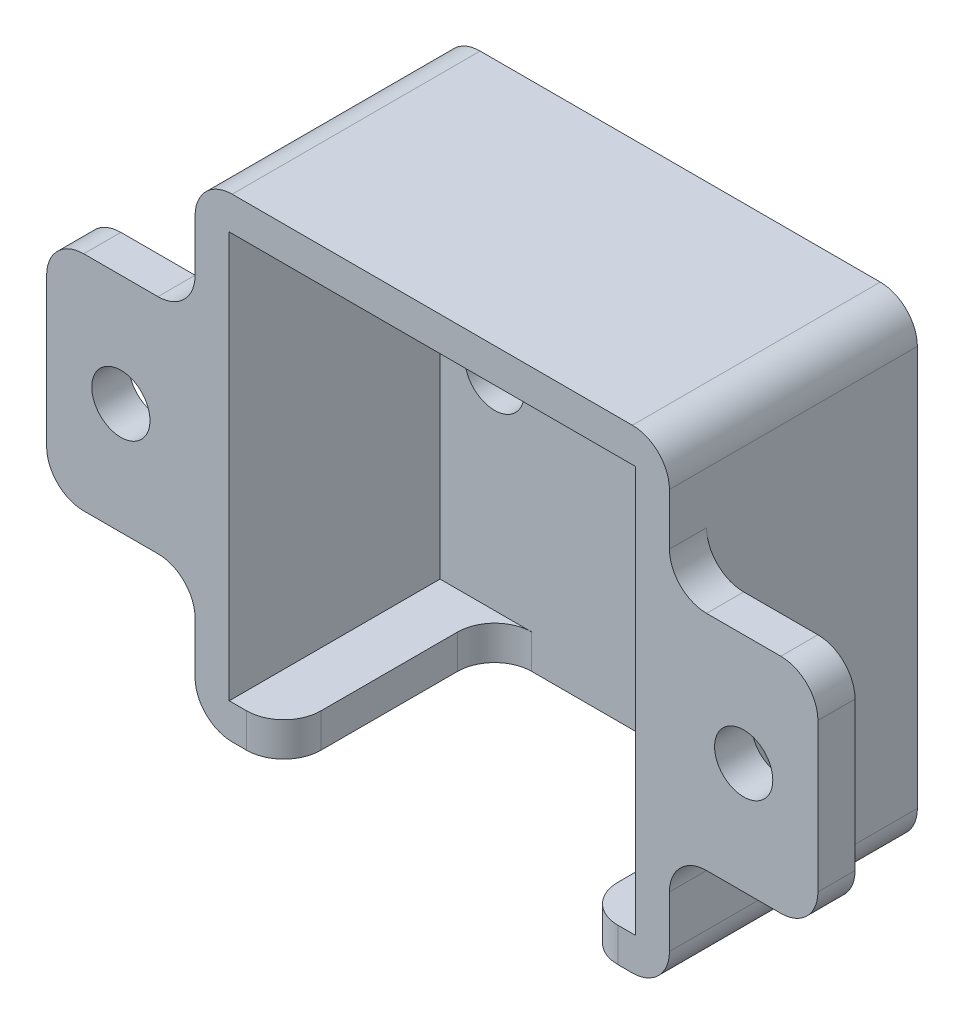
from build123d import *

# Parameters (mm, degrees)
SKETCH1_W           = 40.57777
SKETCH1_H           = 40.57777
SKETCH1_R           = 2.54
BOSS_EXTRUDE1_DEPTH = 1.5875
SKETCH3_W           = 40.57777
SKETCH3_H           = 40.57777
SKETCH3_W_2         = 34.73577
SKETCH3_H_2         = 34.73577
BOSS_EXTRUDE2_DEPTH = 18.034
SKETCH4_W           = 12.7
SKETCH4_H           = 19.05
SKETCH4_R           = 2.4892
BOSS_EXTRUDE3_DEPTH = 3.175
FILLET1_R           = 3.175
SKETCH6_W           = 25.4
SKETCH6_H           = 18.034
CUT_EXTRUDE2_DEPTH  = 3.175
FILLET3_R           = 3.175


with BuildPart() as part:
    # Sketch1 → Boss-Extrude1 (new, symmetric)
    with BuildSketch(Plane.XY):
        Rectangle(SKETCH1_W, SKETCH1_H)
        with Locations((-12.7, 0)):
            Circle(SKETCH1_R, mode=Mode.SUBTRACT)
        with Locations((12.7, 0)):
            Circle(SKETCH1_R, mode=Mode.SUBTRACT)
    extrude(amount=BOSS_EXTRUDE1_DEPTH, both=True)

    # Sketch3 → Boss-Extrude2 (add)
    with BuildSketch(Plane.XY.offset(1.5875)):
        Rectangle(SKETCH3_W, SKETCH3_H)
        Rectangle(SKETCH3_W_2, SKETCH3_H_2, mode=Mode.SUBTRACT)
    extrude(amount=BOSS_EXTRUDE2_DEPTH)

    # Sketch4 → Boss-Extrude3 (add)
    # profile 1 of 2: a face of its own
    with BuildSketch(Plane.XY.offset(19.6215)):
        with Locations((-26.638885, 0)):
            Rectangle(SKETCH4_W, SKETCH4_H)
        with Locations((-26.638885, 0)):
            Circle(SKETCH4_R, mode=Mode.SUBTRACT)
    # profile 2 of 2: a face of its own
    with BuildSketch(Plane.XY.offset(19.6215)):
        with Locations((26.638885, 0)):
            Rectangle(SKETCH4_W, SKETCH4_H)
        with Locations((26.638885, 0)):
            Circle(SKETCH4_R, mode=Mode.SUBTRACT)
    extrude(amount=-BOSS_EXTRUDE3_DEPTH)

    # Fillet1
    fillet1_edges = [part.edges().sort_by_distance(p)[0] for p in [
        (-20.288885, 9.525, 18.034),
        (-20.288885, -9.525, 18.034),
        (-32.988885, -9.525, 18.034),
        (-32.988885, 9.525, 18.034),
        (20.288885, -9.525, 18.034),
        (20.288885, 9.525, 18.034),
        (32.988885, 9.525, 18.034),
        (32.988885, -9.525, 18.034),
        (20.288885, -20.288885, 9.017),
        (-20.288885, -20.288885, 9.017),
        (-20.288885, 20.288885, 9.017),
        (20.288885, 20.288885, 9.017),
    ]]
    fillet(fillet1_edges, radius=FILLET1_R)

    # Sketch6 → Cut-Extrude2 (cut)
    with BuildSketch(Plane.XZ.offset(20.288885)):
        with Locations((0, 10.6045)):
            Rectangle(SKETCH6_W, SKETCH6_H)
    extrude(amount=-CUT_EXTRUDE2_DEPTH, mode=Mode.SUBTRACT)

    # Fillet3
    fillet3_edges = [part.edges().sort_by_distance(p)[0] for p in [
        (-12.7, -18.828385, 1.5875),
        (-12.7, -18.828385, 19.6215),
        (12.7, -18.828385, 19.6215),
        (12.7, -18.828385, 1.5875),
    ]]
    fillet(fillet3_edges, radius=FILLET3_R)


solid = part.part
